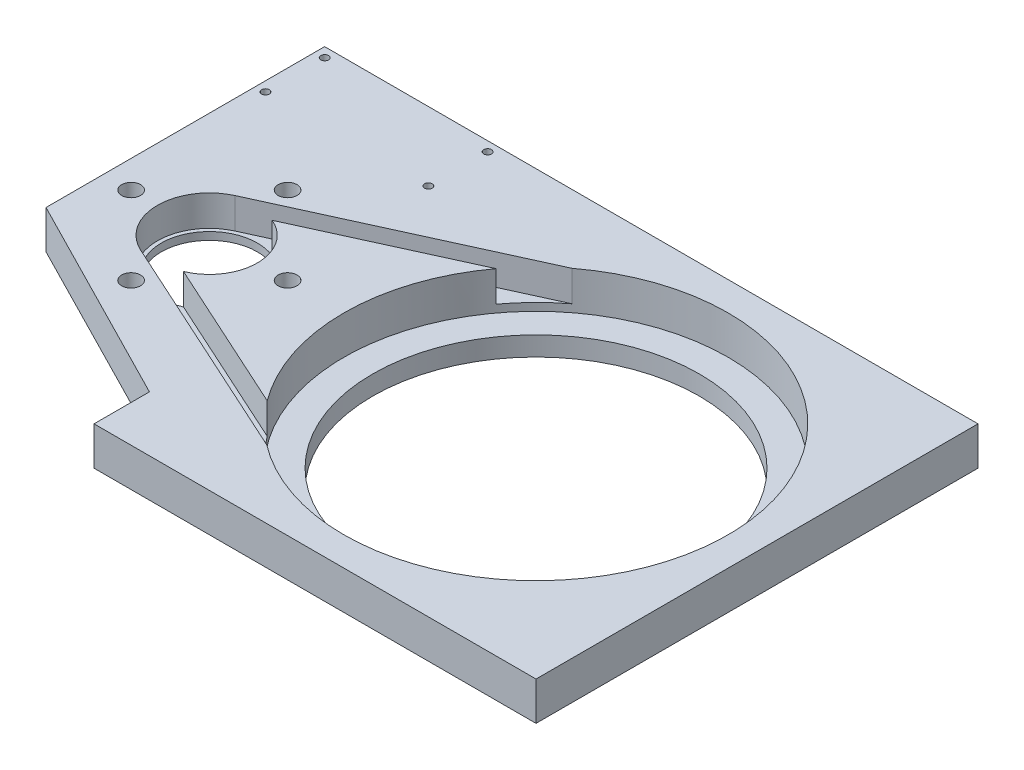
from build123d import *

# Parameters (mm, degrees)
SKETCH1_W             = 105
SKETCH1_H             = 105
BOSS_EXTRUDE1_DEPTH   = 5
SKETCH2_W             = 115
SKETCH2_H             = 115
BOSS_EXTRUDE2_DEPTH   = 10
SKETCH3_R             = 42.5
CUT_EXTRUDE1_DEPTH    = 83.689177043
SKETCH4_R             = 50
CUT_EXTRUDE2_DEPTH    = 10
BOSS_EXTRUDE3_DEPTH   = 10
SKETCH6_R             = 12.5
CUT_EXTRUDE3_DEPTH    = 128.2301065
F_8_CLEARANCE_HOLE1_D = 4.9149
CUT_EXTRUDE4_DEPTH    = 8
SKETCH10_R            = 1
BOSS_EXTRUDE4_DEPTH   = 2


with BuildPart() as part:
    # Sketch1 → Boss-Extrude1 (new body)
    with BuildSketch(Plane(origin=(0, 0, 0), x_dir=(1, 0, 0), z_dir=(0, 1, 0))):
        Rectangle(SKETCH1_W, SKETCH1_H)
    extrude(amount=BOSS_EXTRUDE1_DEPTH)

    # Sketch2 → Boss-Extrude2 (add)
    with BuildSketch(Plane(origin=(0, 5, 0), x_dir=(1, 0, 0), z_dir=(0, 1, 0))):
        Rectangle(SKETCH2_W, SKETCH2_H)
    extrude(amount=BOSS_EXTRUDE2_DEPTH)

    # Sketch3 → Cut-Extrude1 (cut, through all)
    with BuildSketch(Plane(origin=(0, 15, 0), x_dir=(1, 0, 0), z_dir=(0, 1, 0))):
        with Locations(Location((0, 0, 0), (0, 0, 270))):
            Circle(SKETCH3_R)
    extrude(amount=-CUT_EXTRUDE1_DEPTH, mode=Mode.SUBTRACT)

    # Sketch4 → Cut-Extrude2 (cut)
    with BuildSketch(Plane(origin=(0, 15, 0), x_dir=(1, 0, 0), z_dir=(0, 1, 0))):
        with Locations(Location((0, 0, 0), (0, 0, 270))):
            Circle(SKETCH4_R)
    extrude(amount=-CUT_EXTRUDE2_DEPTH, mode=Mode.SUBTRACT)

    # Sketch5 → Boss-Extrude3 (add)
    with BuildSketch(Plane(origin=(0, 15, 0), x_dir=(1, 0, 0), z_dir=(0, 1, 0))):
        Polygon((-57.5, 43.090435246), (-57.5, -43.090435246), (-112.5, -15), (-112.5, 15), align=None)
    extrude(amount=-BOSS_EXTRUDE3_DEPTH)

    # Sketch6 → Cut-Extrude3 (cut, through all)
    with BuildSketch(Plane(origin=(0, 15, 0), x_dir=(1, 0, 0), z_dir=(0, 1, 0))):
        with Locations(Location((-85, 0, 0), (0, 0, 270))):
            Circle(SKETCH6_R)
    extrude(amount=-CUT_EXTRUDE3_DEPTH, mode=Mode.SUBTRACT)

    # #8 Clearance Hole1 (through all)
    with Locations(Plane(origin=(0, 5, 0), x_dir=(-1, 0, 0), z_dir=(0, -1, 0))):
        with Locations((64.64239577, 0), (85, -20.35760423), (105.35760423, 0), (85, 20.35760423)):
            Hole(F_8_CLEARANCE_HOLE1_D / 2)

    # Sketch9 → Cut-Extrude4 (cut)
    with BuildSketch(Plane(origin=(0, 15, 0), x_dir=(1, 0, 0), z_dir=(0, 1, 0))):
        with BuildLine():
            Line((-20.216911765, 44.360331138), (-90.598529412, 12.284399392))
            ThreePointArc((-90.598529412, 12.284399392), (-98.5, 0), (-90.598529412, -12.284399392))
            Line((-90.598529412, -12.284399392), (-20.216911765, -44.360331138))
            ThreePointArc((-20.216911765, -44.360331138), (-16.905258283, -43.122207068), (-18.143382353, -39.810553586))
            Line((-18.143382353, -39.810553586), (-88.525, -7.734621839))
            ThreePointArc((-88.525, -7.734621839), (-93.5, 0), (-88.525, 7.734621839))
            Line((-88.525, 7.734621839), (-18.143382353, 39.810553586))
            ThreePointArc((-18.143382353, 39.810553586), (-16.905258283, 43.122207068), (-20.216911765, 44.360331138))
        make_face()
    extrude(amount=-CUT_EXTRUDE4_DEPTH, mode=Mode.SUBTRACT)

    # Sketch10 → Boss-Extrude4 (add)
    with BuildSketch(Plane(origin=(0, 15, 0), x_dir=(1, 0, 0), z_dir=(0, 1, 0))):
        Polygon((-57.5, 57.5), (-112.5, 57.5), (-112.5, 15), (-57.5, 43.090435246), align=None)
        with Locations(Location((-67.6, 55, 0), (0, 0, 270))):
            Circle(SKETCH10_R, mode=Mode.SUBTRACT)
        with Locations(Location((-67.6, 39.6, 0), (0, 0, 270))):
            Circle(SKETCH10_R, mode=Mode.SUBTRACT)
        with Locations(Location((-110, 55, 0), (0, 0, 270))):
            Circle(SKETCH10_R, mode=Mode.SUBTRACT)
        with Locations(Location((-110, 39.6, 0), (0, 0, 270))):
            Circle(SKETCH10_R, mode=Mode.SUBTRACT)
    extrude(amount=-BOSS_EXTRUDE4_DEPTH)


solid = part.part
